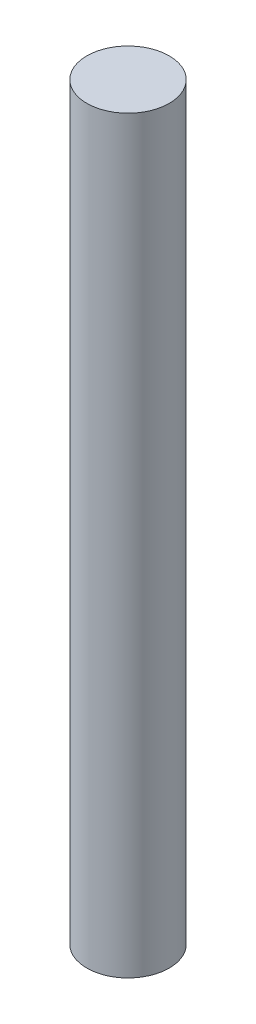
from build123d import *

# Parameters (mm, degrees)
SKETCH1_W = 1.1
SKETCH1_H = 20


with BuildPart() as part:
    # Sketch1 → Tendon (revolve)
    with BuildSketch(Plane.XY, mode=Mode.PRIVATE) as tendon_sk:
        with Locations((0.55, -10)):
            Rectangle(SKETCH1_W, SKETCH1_H)
    revolve(tendon_sk.sketch.rotate(Axis((0, -24, 0), (0, 1, 0)), 90), axis=Axis((0, -24, 0), (0, 1, 0)))


solid = part.part
